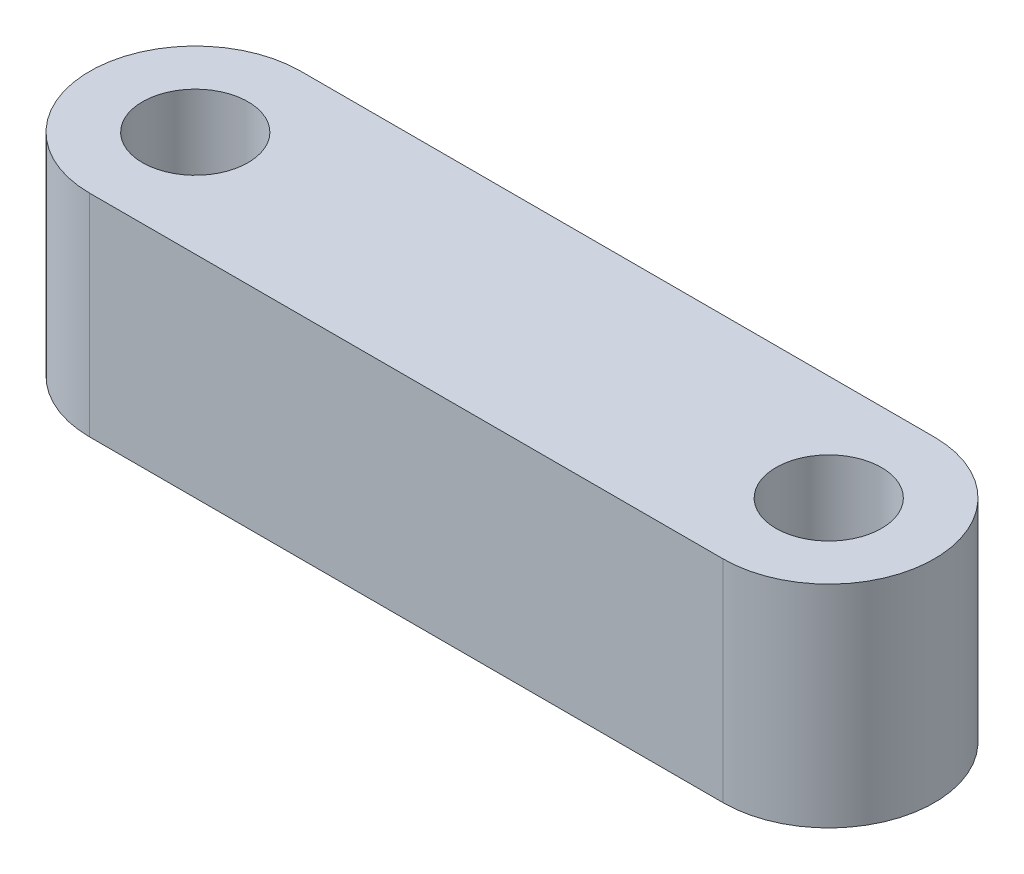
from build123d import *

# Parameters (mm, degrees)
SKETCH1_R           = 2.5
BOSS_EXTRUDE1_DEPTH = 10


with BuildPart() as part:
    # Sketch1 → Boss-Extrude1 (new body)
    with BuildSketch(Plane(origin=(0, 0, 0), x_dir=(1, 0, 0), z_dir=(0, 1, 0))):
        with BuildLine():
            Line((-15, 5), (15, 5))
            ThreePointArc((15, 5), (20, 0), (15, -5))
            Line((15, -5), (-15, -5))
            ThreePointArc((-15, -5), (-20, 0), (-15, 5))
        make_face()
        with Locations(Location((-15, 0, 0), (0, 0, 270))):
            Circle(SKETCH1_R, mode=Mode.SUBTRACT)
        with Locations(Location((15, 0, 0), (0, 0, 270))):
            Circle(SKETCH1_R, mode=Mode.SUBTRACT)
    extrude(amount=BOSS_EXTRUDE1_DEPTH)


solid = part.part
